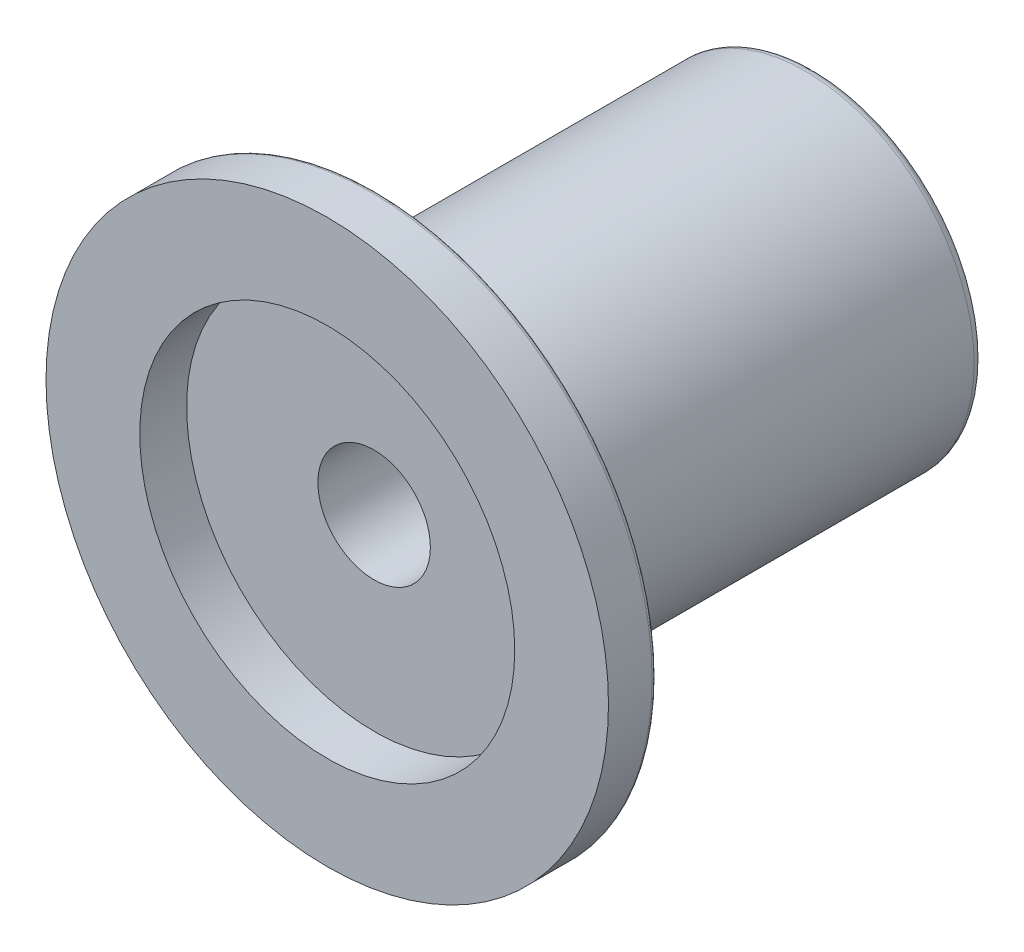
from build123d import *

# Parameters (mm, degrees)
SKETCH2_W          = 0.25
SKETCH2_H          = 3
CUT_EXTRUDE1_DEPTH = 0.25


with BuildPart() as part:
    # Sketch1 → Revolve1 (revolve)
    with BuildSketch(Plane(origin=(0, 0, 0), x_dir=(0, 0, -1), z_dir=(1, 0, 0)), mode=Mode.PRIVATE) as revolve1_sk:
        with BuildLine():
            Line((0, 10), (0, 15))
            Line((0, 15), (2.324948115, 15))
            ThreePointArc((2.324948115, 15), (2.468342225, 14.954788011), (2.559871271, 14.835505036))
            Line((2.559871271, 14.835505036), (4.623950135, 9.164494964))
            ThreePointArc((4.623950135, 9.164494964), (4.715479181, 9.045211989), (4.85887329, 9))
            Line((4.85887329, 9), (25.5, 9))
            ThreePointArc((25.5, 9), (25.853553391, 8.853553391), (26, 8.5))
            Line((26, 8.5), (26, 0))
            Line((26, 0), (23.5, 0))
            Line((23.5, 0), (23.5, 3))
            Line((23.5, 3), (2.5, 3))
            Line((2.5, 3), (2.5, 10))
            Line((2.5, 10), (0, 10))
        make_face()
    revolve(revolve1_sk.sketch.rotate(Axis((0, 0, 0), (0, 0, -1)), 90), axis=Axis((0, 0, 0), (0, 0, -1)))

    # Sketch2 → Cut-Extrude1 (cut)
    with BuildSketch(Plane(origin=(0, 0, -26), x_dir=(-1, 0, 0), z_dir=(0, 0, -1))):
        with Locations((0, 8)):
            Rectangle(SKETCH2_W, SKETCH2_H)
    extrude(amount=-CUT_EXTRUDE1_DEPTH, mode=Mode.SUBTRACT)


solid = part.part
